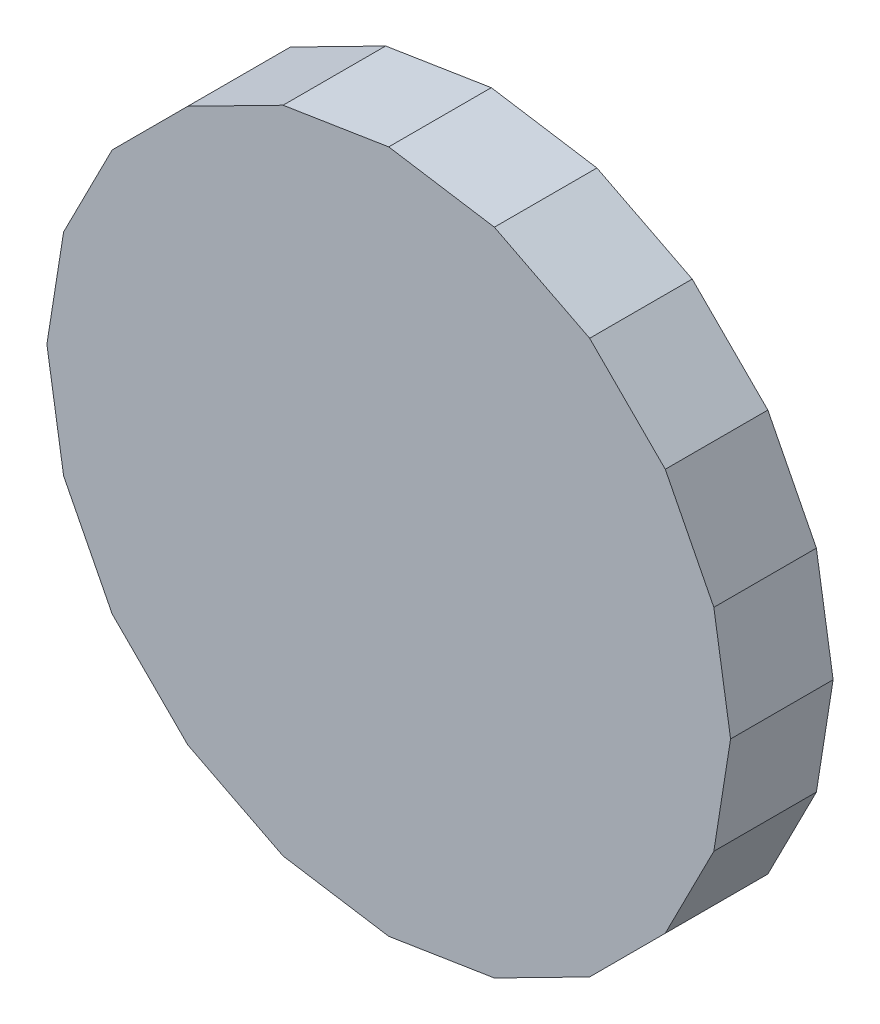
from build123d import *

# Parameters (mm, degrees)
EXTRUDE_1_DEPTH = 30


with BuildPart() as part:
    # 草图1 → 凸台-拉伸1 (new body)
    with BuildSketch(Plane.XY):
        Polygon((100, 0), (95.10565163, 30.901699437), (80.901699437, 58.778525229), (58.778525229, 80.901699437), (30.901699437, 95.10565163), (0, 100), (-30.901699437, 95.10565163), (-58.778525229, 80.901699437), (-80.901699437, 58.778525229), (-95.10565163, 30.901699437), (-100, 0), (-95.10565163, -30.901699437), (-80.901699437, -58.778525229), (-58.778525229, -80.901699437), (-30.901699437, -95.10565163), (0, -100), (30.901699437, -95.10565163), (58.778525229, -80.901699437), (80.901699437, -58.778525229), (95.10565163, -30.901699437), align=None)
    extrude(amount=EXTRUDE_1_DEPTH)


solid = part.part
